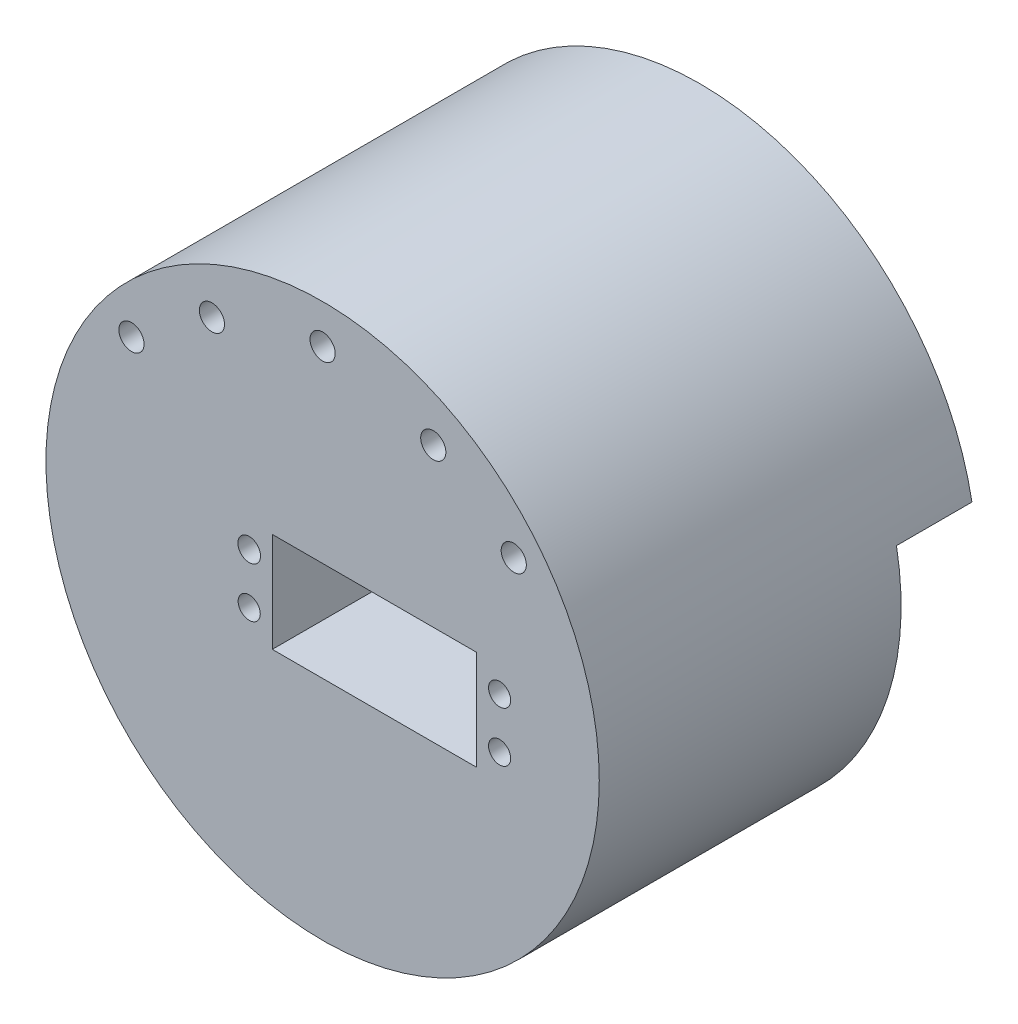
from build123d import *

# Parameters (mm, degrees)
BOSS_EXTRUDE1_DEPTH = 35
BOSS_EXTRUDE2_START = -20
SKETCH2_R           = 55
SKETCH2_R_2         = 39.161040577
BOSS_EXTRUDE2_DEPTH = 40
SKETCH4_R           = 55
BOSS_EXTRUDE3_DEPTH = 20
SKETCH5_R           = 3
CUT_EXTRUDE1_DEPTH  = 20
SKETCH6_R           = 2.5
CUT_EXTRUDE3_DEPTH  = 109.050914096
SKETCH8_R           = 2.25
SKETCH8_R_2         = 2.2
SKETCH8_W           = 40.596274726
SKETCH8_H           = 19.795896112
CUT_EXTRUDE5_DEPTH  = 30


with BuildPart() as part:
    # Sketch1 → Boss-Extrude1 (new body)
    with BuildSketch(Plane.XY):
        with BuildLine():
            add(Edge.make_bspline(
                [(-38, 20), (-28.167603026, 32.926551341), (0, 39.5)],
                knots=[0, 0, 0, 1, 1, 1], degree=2))
            add(Edge.make_bspline(
                [(0, 39.5), (28.167603026, 32.926551341), (38, 20)],
                knots=[0, 0, 0, 1, 1, 1], degree=2))
            Line((38, 20), (38, 10))
            Line((38, 10), (54.083269132, 10))
            ThreePointArc((54.083269132, 10), (0, 55), (-54.083269132, 10))
            Line((-54.083269132, 10), (-38, 10))
            Line((-38, 10), (-38, 20))
        make_face()
    extrude(amount=BOSS_EXTRUDE1_DEPTH)

    # Sketch2 → Boss-Extrude2 (add)
    with BuildSketch(Plane.XY.offset(35).offset(BOSS_EXTRUDE2_START)):
        with Locations(Location((0, 0, 0), (0, 0, 169.524318304))):
            Circle(SKETCH2_R)
        Circle(SKETCH2_R_2, mode=Mode.SUBTRACT)
    extrude(amount=BOSS_EXTRUDE2_DEPTH)

    # Sketch4 → Boss-Extrude3 (add)
    with BuildSketch(Plane.XY.offset(55)):
        with Locations(Location((0, 0, 0), (0, 0, 169.524318304))):
            Circle(SKETCH4_R)
    extrude(amount=BOSS_EXTRUDE3_DEPTH)

    # Sketch5 → Cut-Extrude1 (cut)
    with BuildSketch(Plane.XY.offset(75)):
        Circle(SKETCH5_R)
    extrude(amount=-CUT_EXTRUDE1_DEPTH, mode=Mode.SUBTRACT)

    # Sketch6 → Cut-Extrude3 (cut, through all)
    with BuildSketch(Plane.XY.offset(75)):
        with Locations((-38, 29.880895352)):
            Circle(SKETCH6_R)
        with Locations((-22, 41.266508356)):
            Circle(SKETCH6_R)
        with Locations((0, 47.25)):
            Circle(SKETCH6_R)
        with Locations((22, 41.266508356)):
            Circle(SKETCH6_R)
        with Locations((38, 29.880895352)):
            Circle(SKETCH6_R)
    extrude(amount=-CUT_EXTRUDE3_DEPTH, mode=Mode.SUBTRACT)

    # Sketch8 → Cut-Extrude5 (cut)
    with BuildSketch(Plane.XY.offset(75)):
        with Locations((-14.589613301, 5)):
            Circle(SKETCH8_R)
        with Locations((-14.589613301, -5)):
            Circle(SKETCH8_R_2)
        with Locations((35.189613301, 5)):
            Circle(SKETCH8_R_2)
        with Locations((35.189613301, -5)):
            Circle(SKETCH8_R_2)
        with Locations((10.298137363, 0.002051944)):
            Rectangle(SKETCH8_W, SKETCH8_H)
    extrude(amount=-CUT_EXTRUDE5_DEPTH, mode=Mode.SUBTRACT)


solid = part.part
